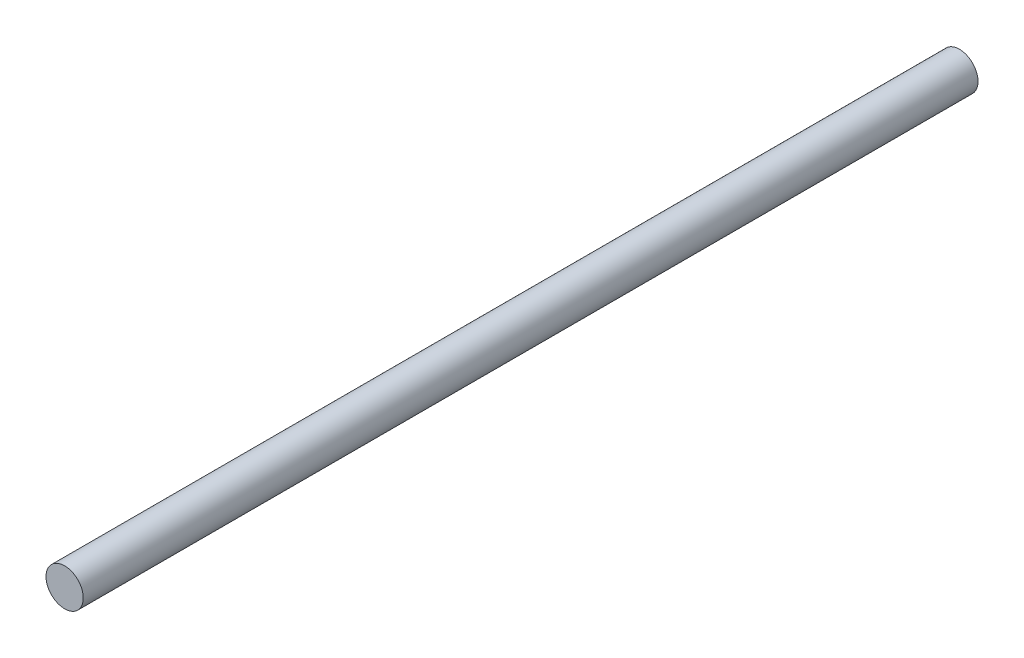
from build123d import *

# Parameters (mm, degrees)
SKETCH1_R           = 1.5875
BOSS_EXTRUDE1_DEPTH = 76.2


with BuildPart() as part:
    # Sketch1 → Boss-Extrude1 (new body)
    with BuildSketch(Plane.XY):
        with Locations(Location((0, 0, 0), (0, 0, 180))):
            Circle(SKETCH1_R)
    extrude(amount=BOSS_EXTRUDE1_DEPTH)


solid = part.part
